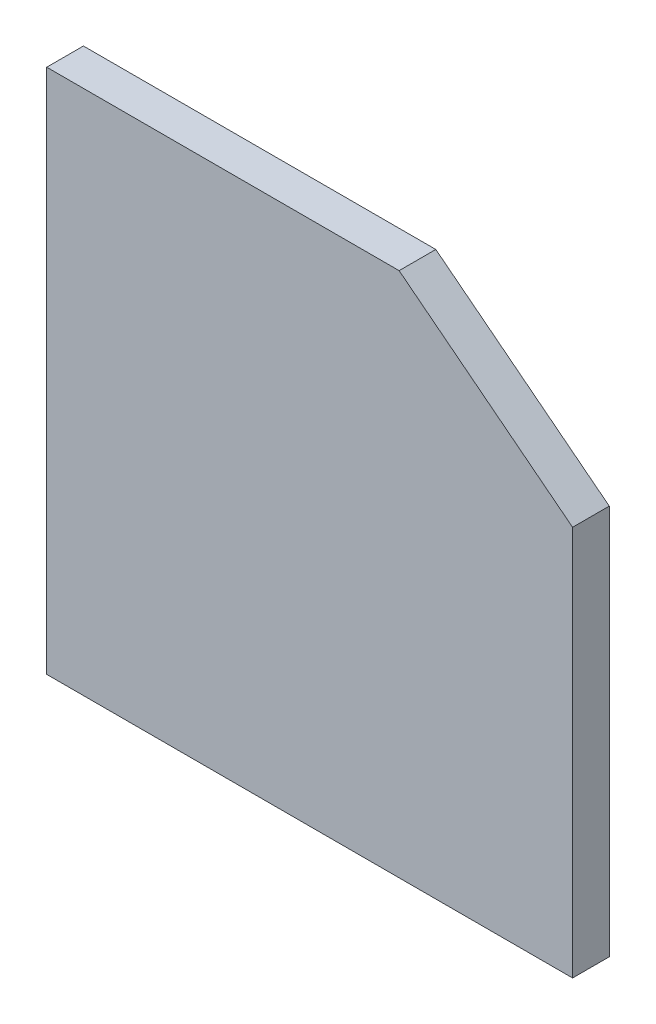
from build123d import *

# Parameters (mm, degrees)
BOSS_EXTRUDE1_DEPTH = 3


with BuildPart() as part:
    # Sketch1 → Boss-Extrude1 (new body)
    with BuildSketch(Plane.XY):
        Polygon((43, 31.918093444), (28.815806435, 43), (0, 43), (0, 0), (43, 0), align=None)
    extrude(amount=BOSS_EXTRUDE1_DEPTH)


solid = part.part
